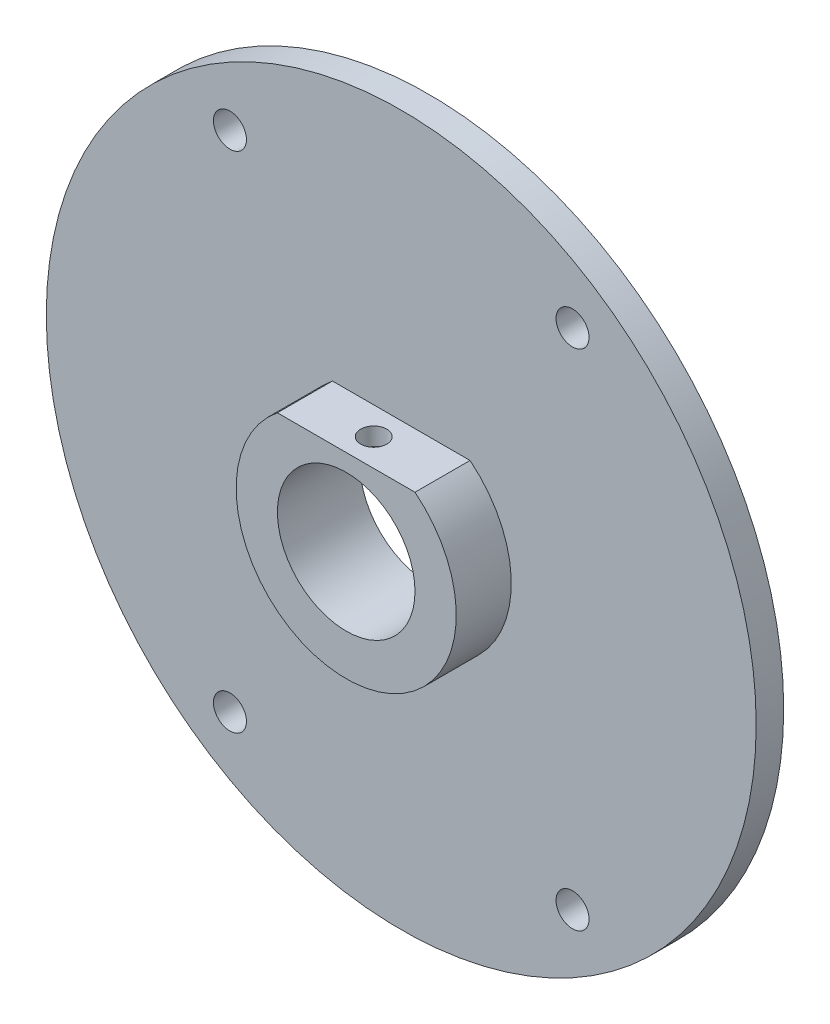
from build123d import *

# Parameters (mm, degrees)
SKETCH_1_R          = 5
SKETCH_1_R_2        = 1.2
EXTRUDE_1_DEPTH     = 2
SKETCH_2_R          = 5
EXTRUDE_2_DEPTH     = 4
CUT_EXTRUDE_1_DEPTH = 4


with BuildPart() as part:
    # 草图1 → 凸台-拉伸1 (new body)
    # profile 1 of 9: a face of its own
    with BuildSketch(Plane.XY):
        with BuildLine():
            Line((50.787618615, 13.919461135), (48.798857294, 18.312980654))
            ThreePointArc((48.798857294, 18.312980654), (40.538542245, 4), (43.589554969, -12.241475957))
            ThreePointArc((43.589554969, -12.241475957), (45.937273528, -15.497674419), (48.798857294, -18.312980654))
            Line((48.798857294, -18.312980654), (53.988393324, -6.848393324))
            Line((53.988393324, -6.848393324), (54.3, -7.16))
            Line((54.3, -7.16), (54.3, -21.733614518))
            ThreePointArc((54.3, -21.733614518), (64, -23.8), (73.7, -21.733614518))
            Line((73.7, -21.733614518), (73.7, -6.915634891))
            Line((73.7, -6.915634891), (74.1123773, -7.071013151))
            Line((74.1123773, -7.071013151), (79.201142706, -18.312980654))
            ThreePointArc((79.201142706, -18.312980654), (85.543295899, -10.115651328), (87.8, 0))
            ThreePointArc((87.8, 0), (85.543295899, 10.115651328), (79.201142706, 18.312980654))
            Line((79.201142706, 18.312980654), (76.899825635, 13.228971143))
            Line((76.899825635, 13.228971143), (73.7, 14.677397496))
            Line((73.7, 14.677397496), (73.7, 21.733614518))
            ThreePointArc((73.7, 21.733614518), (70.904263941, 22.776548014), (68, 23.461457755))
            ThreePointArc((68, 23.461457755), (64, 23.8), (60, 23.461457755))
            ThreePointArc((60, 23.461457755), (57.095736059, 22.776548014), (54.3, 21.733614518))
            Line((54.3, 21.733614518), (54.3, 13.919461135))
            Line((54.3, 13.919461135), (50.787618615, 13.919461135))
        make_face()
        with Locations((64, 0)):
            Circle(SKETCH_1_R, mode=Mode.SUBTRACT)
    # profile 2 of 9: a face of its own
    with BuildSketch(Plane.XY):
        with BuildLine():
            ThreePointArc((43.589554969, -12.241475957), (40.538542245, 4), (48.798857294, 18.312980654))
            ThreePointArc((48.798857294, 18.312980654), (51.432505778, 20.211335655), (54.3, 21.733614518))
            ThreePointArc((54.3, 21.733614518), (57.095736059, 22.776548014), (60, 23.461457755))
            Line((60, 23.461457755), (60, 25.488036409))
            ThreePointArc((60, 25.488036409), (40.557730485, 10.774970998), (42.051507242, -13.561108569))
            Line((42.051507242, -13.561108569), (43.589554969, -12.241475957))
        make_face()
    # profile 3 of 9: a face of its own
    with BuildSketch(Plane.XY):
        with BuildLine():
            ThreePointArc((54.3, -21.733614518), (51.432505778, -20.211335655), (48.798857294, -18.312980654))
            Line((48.798857294, -18.312980654), (47.260809567, -19.632613266))
            ThreePointArc((47.260809567, -19.632613266), (74.811310902, -23.425532152), (89.8, 0))
            ThreePointArc((89.8, 0), (83.606631531, 16.76961538), (68, 25.488036409))
            Line((68, 25.488036409), (68, 23.461457755))
            ThreePointArc((68, 23.461457755), (70.904263941, 22.776548014), (73.7, 21.733614518))
            ThreePointArc((73.7, 21.733614518), (76.567494222, 20.211335655), (79.201142706, 18.312980654))
            ThreePointArc((79.201142706, 18.312980654), (85.543295899, 10.115651328), (87.8, 0))
            ThreePointArc((87.8, 0), (85.543295899, -10.115651328), (79.201142706, -18.312980654))
            ThreePointArc((79.201142706, -18.312980654), (76.567494222, -20.211335655), (73.7, -21.733614518))
            ThreePointArc((73.7, -21.733614518), (64, -23.8), (54.3, -21.733614518))
        make_face()
    # profile 4 of 9: a face of its own
    with BuildSketch(Plane.XY):
        with BuildLine():
            Line((60, 25.488036409), (60, 23.461457755))
            ThreePointArc((60, 23.461457755), (64, 23.8), (68, 23.461457755))
            Line((68, 23.461457755), (68, 25.488036409))
            ThreePointArc((68, 25.488036409), (64, 25.8), (60, 25.488036409))
        make_face()
    # profile 5 of 9: a face of its own
    with BuildSketch(Plane.XY):
        with BuildLine():
            ThreePointArc((48.798857294, -18.312980654), (45.937273528, -15.497674419), (43.589554969, -12.241475957))
            Line((43.589554969, -12.241475957), (42.051507242, -13.561108569))
            ThreePointArc((42.051507242, -13.561108569), (44.419397354, -16.8), (47.260809567, -19.632613266))
            Line((47.260809567, -19.632613266), (48.798857294, -18.312980654))
        make_face()
    # profile 6 of 9: a face of its own
    with BuildSketch(Plane.XY):
        with BuildLine():
            Line((53.988393324, -6.848393324), (48.798857294, -18.312980654))
            ThreePointArc((48.798857294, -18.312980654), (51.432505778, -20.211335655), (54.3, -21.733614518))
            Line((54.3, -21.733614518), (54.3, -7.16))
            Line((54.3, -7.16), (53.988393324, -6.848393324))
        make_face()
        with Locations((51.549428647, -18.312980654)):
            Circle(SKETCH_1_R_2, mode=Mode.SUBTRACT)
    # profile 7 of 9: a face of its own
    with BuildSketch(Plane.XY):
        with BuildLine():
            Line((73.7, -6.915634891), (73.7, -21.733614518))
            ThreePointArc((73.7, -21.733614518), (76.567494222, -20.211335655), (79.201142706, -18.312980654))
            Line((79.201142706, -18.312980654), (74.1123773, -7.071013151))
            Line((74.1123773, -7.071013151), (73.7, -6.915634891))
        make_face()
        with Locations((76.450571353, -18.312980654)):
            Circle(SKETCH_1_R_2, mode=Mode.SUBTRACT)
    # profile 8 of 9: a face of its own
    with BuildSketch(Plane.XY):
        with BuildLine():
            ThreePointArc((79.201142706, 18.312980654), (76.567494222, 20.211335655), (73.7, 21.733614518))
            Line((73.7, 21.733614518), (73.7, 14.677397496))
            Line((73.7, 14.677397496), (76.899825635, 13.228971143))
            Line((76.899825635, 13.228971143), (79.201142706, 18.312980654))
        make_face()
        with Locations((76.450571353, 18.312980654)):
            Circle(SKETCH_1_R_2, mode=Mode.SUBTRACT)
    # profile 9 of 9: a face of its own
    with BuildSketch(Plane.XY):
        with BuildLine():
            ThreePointArc((54.3, 21.733614518), (51.432505778, 20.211335655), (48.798857294, 18.312980654))
            Line((48.798857294, 18.312980654), (50.787618615, 13.919461135))
            Line((50.787618615, 13.919461135), (54.3, 13.919461135))
            Line((54.3, 13.919461135), (54.3, 21.733614518))
        make_face()
        with Locations((51.549428647, 18.312980654)):
            Circle(SKETCH_1_R_2, mode=Mode.SUBTRACT)
    extrude(amount=EXTRUDE_1_DEPTH)

    # 草图2 → 凸台-拉伸2 (add)
    with BuildSketch(Plane.XY.offset(2)):
        with BuildLine():
            ThreePointArc((72, 0), (71.211102551, 3.464101615), (69, 6.244997998))
            Line((69, 6.244997998), (59, 6.244997998))
            ThreePointArc((59, 6.244997998), (60.535898385, -7.211102551), (72, 0))
        make_face()
        with Locations((64, 0)):
            Circle(SKETCH_2_R, mode=Mode.SUBTRACT)
    extrude(amount=EXTRUDE_2_DEPTH)

    # 草图3 → 切除-拉伸1 (cut)
    with BuildSketch(Plane(origin=(0, 6.244997998, 0), x_dir=(1, 0, 0), z_dir=(0, 1, 0))):
        with BuildLine():
            ThreePointArc((64.95, -4), (64.932858567, -3.820347855), (64.882052856, -3.647178857))
            Line((64.882052856, -3.647178857), (63.117947144, -4.352821143))
            ThreePointArc((63.117947144, -4.352821143), (64.179652145, -4.932858567), (64.95, -4))
        make_face()
        with BuildLine():
            Line((63.117947144, -4.352821143), (64.882052856, -3.647178857))
            ThreePointArc((64.882052856, -3.647178857), (63.647178857, -3.117947144), (63.117947144, -4.352821143))
        make_face()
    extrude(amount=-CUT_EXTRUDE_1_DEPTH, mode=Mode.SUBTRACT)


solid = part.part
